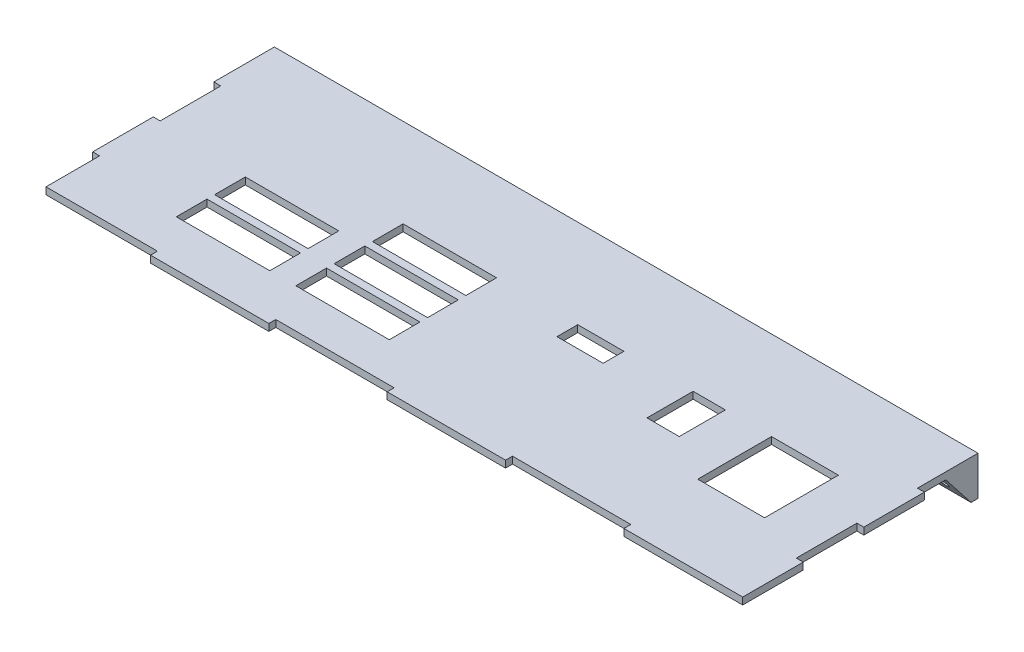
from build123d import *

# Parameters (mm, degrees)
EXTRUDE_1_DEPTH     = 3
SKETCH_2_W          = 40.5
SKETCH_2_H          = 13.3
SKETCH_2_W_2        = 20
SKETCH_2_H_2        = 9
SKETCH_2_W_3        = 14
SKETCH_2_H_3        = 20
SKETCH_2_W_4        = 29
SKETCH_2_H_4        = 32
CUT_EXTRUDE_1_DEPTH = 3
SKETCH_3_W          = 51.3
SKETCH_3_H          = 3
CUT_EXTRUDE_2_DEPTH = 3
SKETCH_4_W          = 4
SKETCH_4_H          = 28
SKETCH_4_W_2        = 14
SKETCH_4_H_2        = 14
EXTRUDE_2_DEPTH     = 14
CUT_EXTRUDE_3_DEPTH = 14
CUT_EXTRUDE_4_DEPTH = 14
CUT_EXTRUDE_5_DEPTH = 14
CUT_EXTRUDE_6_REACH = 216.55
SKETCH_9_R          = 2.5


with BuildPart() as part:
    # Эскиз1 → Бобышка-Вытянуть1 (new body)
    with BuildSketch(Plane(origin=(0, 0, 0), x_dir=(1, 0, 0), z_dir=(0, 1, 0))):
        Polygon((-121.424018304, 15.144551695), (-121.424018304, 41.394551695), (183.575981696, 41.394551695), (183.575981696, 15.144551695), (186.575981696, 15.144551695), (186.575981696, -11.105448305), (183.575981696, -11.105448305), (183.575981696, -37.355448305), (186.575981696, -37.355448305), (186.575981696, -63.605448305), (-118.424018304, -63.605448305), (-118.424018304, -37.355448305), (-121.424018304, -37.355448305), (-121.424018304, -11.105448305), (-118.424018304, -11.105448305), (-118.424018304, 15.144551695), align=None)
    extrude(amount=EXTRUDE_1_DEPTH)

    # Эскиз2 → Вырез-Вытянуть1 (cut)
    with BuildSketch(Plane(origin=(0, 3, 0), x_dir=(1, 0, 0), z_dir=(0, 1, 0))):
        with Locations((-58.674018304, -36.955448305)):
            Rectangle(SKETCH_2_W, SKETCH_2_H)
        with Locations((-6.874018304, -36.955448305)):
            Rectangle(SKETCH_2_W, SKETCH_2_H)
        with Locations((-6.874018304, -20.355448305)):
            Rectangle(SKETCH_2_W, SKETCH_2_H)
        with Locations((-58.674018304, -20.355448305)):
            Rectangle(SKETCH_2_W, SKETCH_2_H)
        with Locations((-6.874018304, -3.755448305)):
            Rectangle(SKETCH_2_W, SKETCH_2_H)
        with Locations((58.575981696, -1.605448305)):
            Rectangle(SKETCH_2_W_2, SKETCH_2_H_2)
        with Locations((105.575981696, -7.105448305)):
            Rectangle(SKETCH_2_W_3, SKETCH_2_H_3)
        with Locations((147.075981696, -13.105448305)):
            Rectangle(SKETCH_2_W_4, SKETCH_2_H_4)
    extrude(amount=-CUT_EXTRUDE_1_DEPTH, mode=Mode.SUBTRACT)

    # Эскиз3 → Вырез-Вытянуть2 (cut)
    with BuildSketch(Plane(origin=(0, 3, 0), x_dir=(1, 0, 0), z_dir=(0, 1, 0))):
        with Locations((-95.774018304, -62.105448305)):
            Rectangle(SKETCH_3_W, SKETCH_3_H)
        with Locations((6.825981696, -62.105448305)):
            Rectangle(SKETCH_3_W, SKETCH_3_H)
        with Locations((109.425981696, -62.105448305)):
            Rectangle(SKETCH_3_W, SKETCH_3_H)
    extrude(amount=-CUT_EXTRUDE_2_DEPTH, mode=Mode.SUBTRACT)

    # Эскиз4 → Бобышка-Вытянуть2 (add)
    with BuildSketch(Plane.XZ):
        with Locations((27.575981696, -27.394551695)):
            Rectangle(SKETCH_4_W, SKETCH_4_H)
        with Locations((-111.424018304, -34.394551695)):
            Rectangle(SKETCH_4_W_2, SKETCH_4_H_2)
        with Locations((176.575981696, -34.394551695)):
            Rectangle(SKETCH_4_W_2, SKETCH_4_H_2)
        with Locations((37.575981696, -27.394551695)):
            Rectangle(SKETCH_4_W, SKETCH_4_H)
    extrude(amount=EXTRUDE_2_DEPTH)

    # Эскиз6 → Вырез-Вытянуть3 (cut)
    with BuildSketch(Plane(origin=(39.575981696, 0, 0), x_dir=(0, 0, -1), z_dir=(1, 0, 0))):
        Polygon((13.394551695, -14), (13.394551695, 0), (38.394551695, -14), align=None)
    extrude(amount=-CUT_EXTRUDE_3_DEPTH, mode=Mode.SUBTRACT)

    # Эскиз7 → Вырез-Вытянуть4 (cut)
    with BuildSketch(Plane(origin=(183.575981696, 0, 0), x_dir=(0, 0, -1), z_dir=(1, 0, 0))):
        Polygon((27.394551695, -14), (27.394551695, 0), (38.394551695, -14), align=None)
    extrude(amount=-CUT_EXTRUDE_4_DEPTH, mode=Mode.SUBTRACT)

    # Эскиз8 → Вырез-Вытянуть5 (cut)
    with BuildSketch(Plane(origin=(-104.424018304, 0, 0), x_dir=(0, 0, -1), z_dir=(1, 0, 0))):
        Polygon((27.394551695, -14), (27.394551695, 0), (38.394551695, -14), align=None)
    extrude(amount=-CUT_EXTRUDE_5_DEPTH, mode=Mode.SUBTRACT)

    # Вырез-Вытянуть6: up to this plane
    cut_extrude_6_end = Plane(origin=(169.575981696, -14, -38.394551695), z_dir=(0, 0.6178215519319037, -0.7863183388224225))
    # Эскиз9 → Вырез-Вытянуть6 (cut, up to the surface)
    with BuildSketch(Plane(origin=(0, 0, -41.394551695), x_dir=(-1, 0, 0), z_dir=(0, 0, -1)), mode=Mode.PRIVATE) as cut_extrude_6_sk1:
        with Locations((-176.575981696, -7)):
            Circle(SKETCH_9_R)
    cut_extrude_6_tool1 = split(extrude(cut_extrude_6_sk1.sketch, amount=-CUT_EXTRUDE_6_REACH, mode=Mode.PRIVATE), bisect_by=cut_extrude_6_end, keep=Keep.BOTH, mode=Mode.PRIVATE)
    add(cut_extrude_6_tool1.solids().sort_by_distance((176.575982, -7, -41.394552))[0], mode=Mode.SUBTRACT)
    # Эскиз9 → Вырез-Вытянуть6 (cut, up to the surface)
    with BuildSketch(Plane(origin=(0, 0, -41.394551695), x_dir=(-1, 0, 0), z_dir=(0, 0, -1)), mode=Mode.PRIVATE) as cut_extrude_6_sk2:
        with Locations((111.424018304, -7)):
            Circle(SKETCH_9_R)
    cut_extrude_6_tool2 = split(extrude(cut_extrude_6_sk2.sketch, amount=-CUT_EXTRUDE_6_REACH, mode=Mode.PRIVATE), bisect_by=cut_extrude_6_end, keep=Keep.BOTH, mode=Mode.PRIVATE)
    add(cut_extrude_6_tool2.solids().sort_by_distance((-111.424018, -7, -41.394552))[0], mode=Mode.SUBTRACT)


solid = part.part
